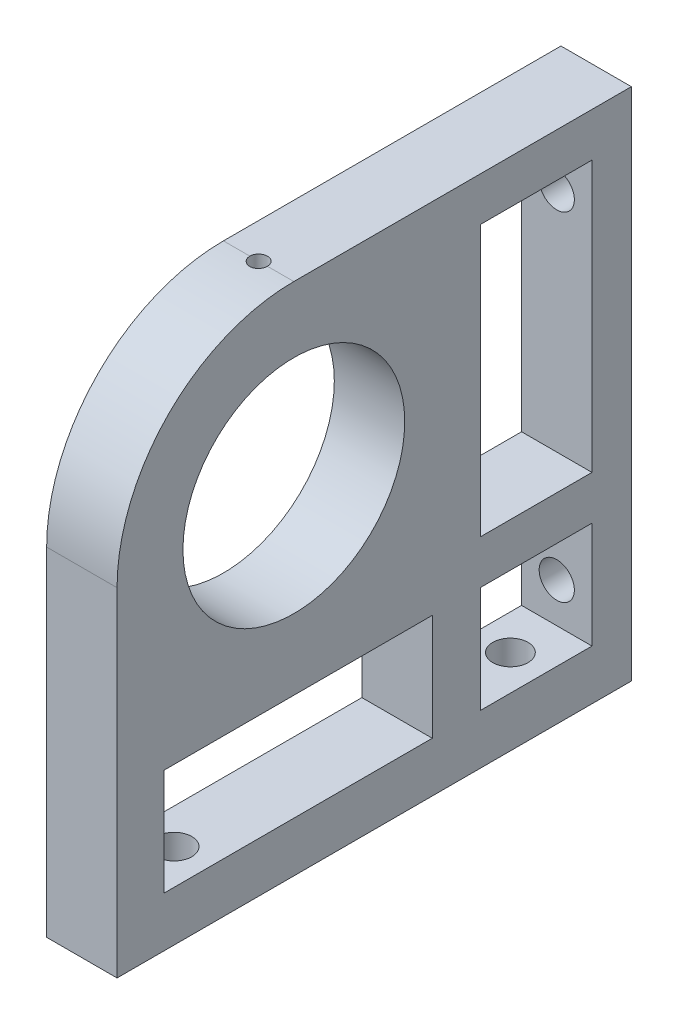
from build123d import *

# Parameters (mm, degrees)
SKETCH1_R           = 20
BOSS_EXTRUDE1_DEPTH = 12.7
SKETCH2_R           = 1.5875
CUT_EXTRUDE1_DEPTH  = 88.081184849
SKETCH4_W           = 20.078494948
SKETCH4_H           = 48.78095735
SKETCH4_W_2         = 48.420880553
SKETCH4_H_2         = 19.195923741
CUT_EXTRUDE2_DEPTH  = 26.162
SKETCH5_R           = 3.175
CUT_EXTRUDE3_DEPTH  = 11.43
SKETCH6_R           = 3.175
CUT_EXTRUDE4_DEPTH  = 11.43


with BuildPart() as part:
    # Sketch1 → Boss-Extrude1 (new body)
    with BuildSketch(Plane(origin=(0, 0, 0), x_dir=(0, 0, -1), z_dir=(1, 0, 0))):
        with BuildLine():
            Line((0, 31.882172919), (31.882172919, 31.882172919))
            Line((31.882172919, 31.882172919), (60.87463474, 31.882172919))
            Line((60.87463474, 31.882172919), (60.87463474, -60.96))
            Line((60.87463474, -60.96), (-31.882172919, -60.96))
            Line((-31.882172919, -60.96), (-31.882172919, 0))
            ThreePointArc((-31.882172919, 0), (-22.54410067, 22.54410067), (0, 31.882172919))
        make_face()
        Circle(SKETCH1_R, mode=Mode.SUBTRACT)
    extrude(amount=BOSS_EXTRUDE1_DEPTH)

    # Sketch2 → Cut-Extrude1 (cut, through all)
    with BuildSketch(Plane(origin=(0, 0, 0), x_dir=(1, 0, 0), z_dir=(0, 1, 0))):
        with Locations(Location((6.35, 0, 0), (0, 0, 90))):
            Circle(SKETCH2_R)
    extrude(amount=CUT_EXTRUDE1_DEPTH, mode=Mode.SUBTRACT)

    # Sketch4 → Cut-Extrude2 (cut)
    with BuildSketch(Plane.ZY):
        with Locations((-43.731401429, -0.427222634)):
            Rectangle(SKETCH4_W, SKETCH4_H)
        with Locations((-0.75610861, -42.339905849)):
            Rectangle(SKETCH4_W_2, SKETCH4_H_2)
        with Locations((-43.731401429, -42.339905849)):
            Rectangle(SKETCH4_W, SKETCH4_H_2)
    extrude(amount=-CUT_EXTRUDE2_DEPTH, mode=Mode.SUBTRACT)

    # Sketch5 → Cut-Extrude3 (cut)
    with BuildSketch(Plane(origin=(0, 0, -60.87463474), x_dir=(-1, 0, 0), z_dir=(0, 0, -1))):
        with Locations((-6.35, 16.187024645)):
            Circle(SKETCH5_R)
        with Locations((-6.35, -44.788648077)):
            Circle(SKETCH5_R)
    extrude(amount=-CUT_EXTRUDE3_DEPTH, mode=Mode.SUBTRACT)

    # Sketch6 → Cut-Extrude4 (cut)
    with BuildSketch(Plane.XZ.offset(60.96)):
        with Locations(Location((6.35, 15.24, 0), (0, 0, 270))):
            Circle(SKETCH6_R)
        with Locations(Location((6.35, -45.41055385, 0), (0, 0, 270))):
            Circle(SKETCH6_R)
    extrude(amount=-CUT_EXTRUDE4_DEPTH, mode=Mode.SUBTRACT)


solid = part.part
